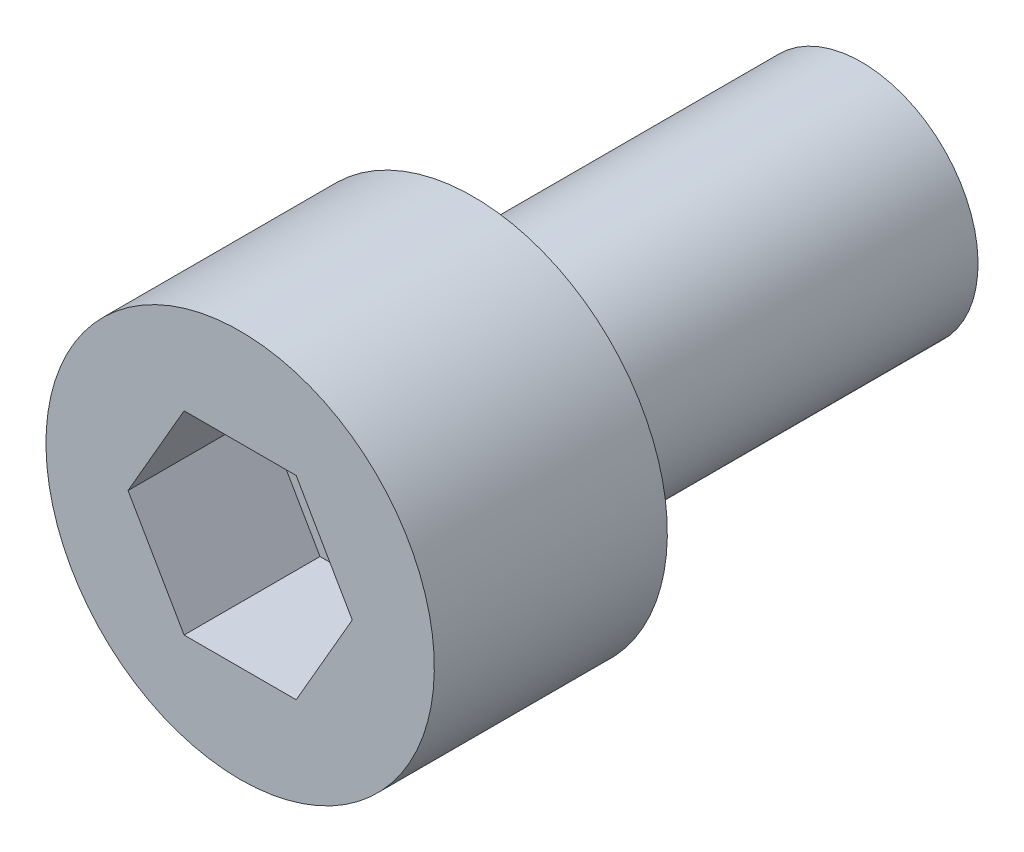
from build123d import *

# Parameters (mm, degrees)
CUT_EXTRUDE1_DEPTH = 3.5


with BuildPart() as part:
    # Sketch1 → Revolve1 (revolve)
    with BuildSketch(Plane(origin=(0, 0, 0), x_dir=(0, 0, -1), z_dir=(1, 0, 0))):
        Polygon((-6, 0), (-6, 5), (0, 5), (0, 3), (10, 3), (10, 0), align=None)
    revolve(axis=Axis((0, 0, 5.584882278), (0, 0, -1)))

    # Sketch2 → Cut-Extrude1 (cut)
    with BuildSketch(Plane.XY.offset(6)):
        Polygon((1.443375673, -2.5), (2.886751346, 0), (1.443375673, 2.5), (-1.443375673, 2.5), (-2.886751346, 0), (-1.443375673, -2.5), align=None)
    extrude(amount=-CUT_EXTRUDE1_DEPTH, mode=Mode.SUBTRACT)


solid = part.part
